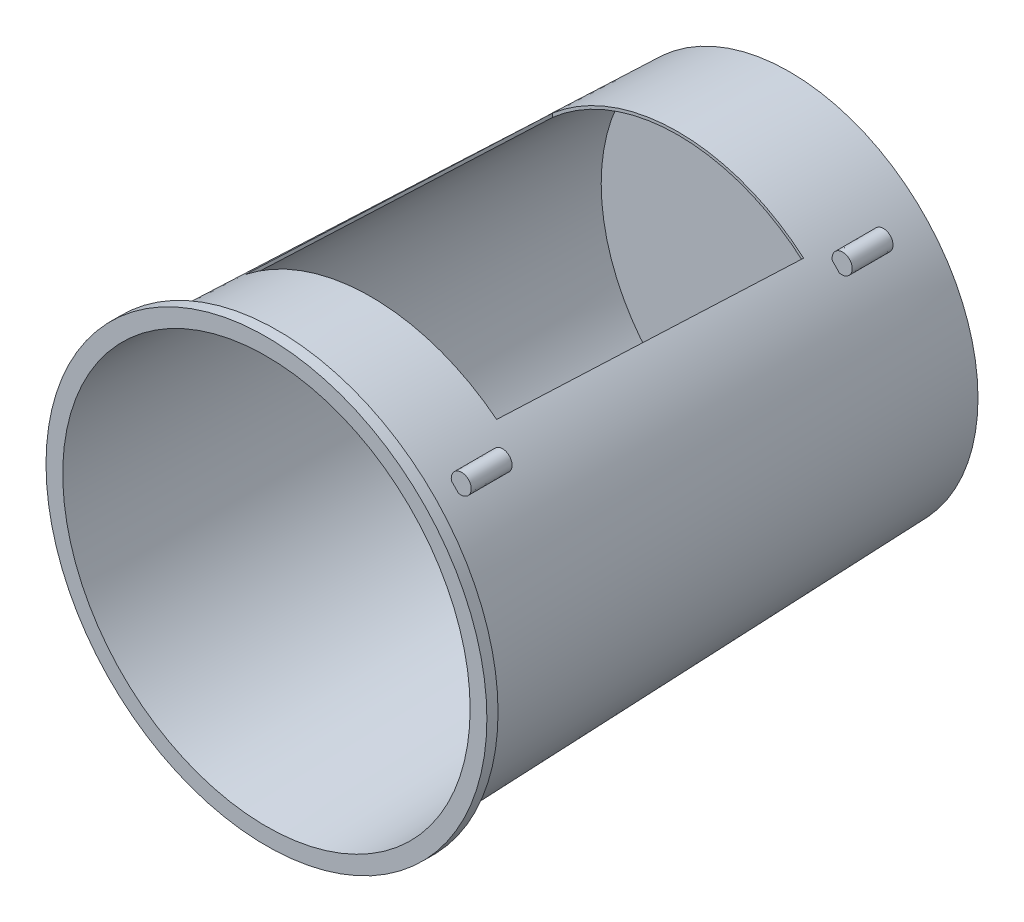
from build123d import *

# Parameters (mm, degrees)
TAPERED_PAIL_BLANK_START  = -190
PAIL_BASE_PROFILE_R       = 135
TAPERED_PAIL_BLANK_DEPTH  = 375
TAPERED_PAIL_BLANK_DRAFT  = -1.985458585
PAIL_WALL_2MM_T           = -2
PAIL_REINFORCED_RIM_START = 177
PAIL_RIM_PROFILE_R        = 158
PAIL_RIM_PROFILE_R_2      = 146
PAIL_REINFORCED_RIM_DEPTH = 8
LOADING_OPENING_PROFILE_W = 220
LOADING_OPENING_PROFILE_H = 250
TOP_LOADING_OPENING_DEPTH = 90


with BuildPart() as part:
    # Pail_Base_Profile → Tapered_Pail_Blank (with draft: the straight prism first)
    with BuildSketch(Plane.XY.offset(TAPERED_PAIL_BLANK_START)):
        Circle(PAIL_BASE_PROFILE_R)
    extrude(amount=TAPERED_PAIL_BLANK_DEPTH)
    # Tapered_Pail_Blank: the draft: its side faces are tilted about the plane it starts from
    tapered_pail_blank_sides = [part.faces().sort_by_distance(p)[0] for p in [
        (-135, 0, -2.5),
    ]]
    draft(tapered_pail_blank_sides, Plane.XY.offset(TAPERED_PAIL_BLANK_START), TAPERED_PAIL_BLANK_DRAFT)

    # Pail_Wall_2mm
    pail_wall_2mm_openings = [part.faces().sort_by_distance(p)[0] for p in [
        (0, 0, 185),
    ]]
    offset(amount=PAIL_WALL_2MM_T, openings=pail_wall_2mm_openings, kind=Kind.INTERSECTION)

    # Pail_Rim_Profile → Pail_Reinforced_Rim (add)
    with BuildSketch(Plane.XY.offset(PAIL_REINFORCED_RIM_START)):
        Circle(PAIL_RIM_PROFILE_R)
        Circle(PAIL_RIM_PROFILE_R_2, mode=Mode.SUBTRACT)
    extrude(amount=PAIL_REINFORCED_RIM_DEPTH)

    # Loading_Opening_Profile → Top_Loading_Opening (cut, symmetric)
    with BuildSketch(Plane(origin=(0, 0, 0), x_dir=(0, 0, -1), z_dir=(1, 0, 0))):
        with Locations((0, 125)):
            Rectangle(LOADING_OPENING_PROFILE_W, LOADING_OPENING_PROFILE_H)
    extrude(amount=TOP_LOADING_OPENING_DEPTH, both=True, mode=Mode.SUBTRACT)

    # Drum_Hinge_Knuckle_Profile → Drum_Hinge_Knuckles (revolve)
    with BuildSketch(Plane(origin=(0, 0, 0), x_dir=(0, 0, 1), z_dir=(0.6974653404967203, -0.7166185169291917, 0))):
        Polygon((-155, -142.213651728), (-125.000089364, -143.255770649), (-125.243089364, -150.251112671), (-155.243, -149.208993749), align=None)
        Polygon((125, -151.920290486), (154.999910636, -152.962409408), (154.756910636, -159.95775143), (124.757, -158.915632508), align=None)
    revolve(axis=Axis((101.521807726, 98.808418315, -169.999121159), (0.024888838213313905, 0.024223630298311177, 0.9993966987475805)))


solid = part.part
